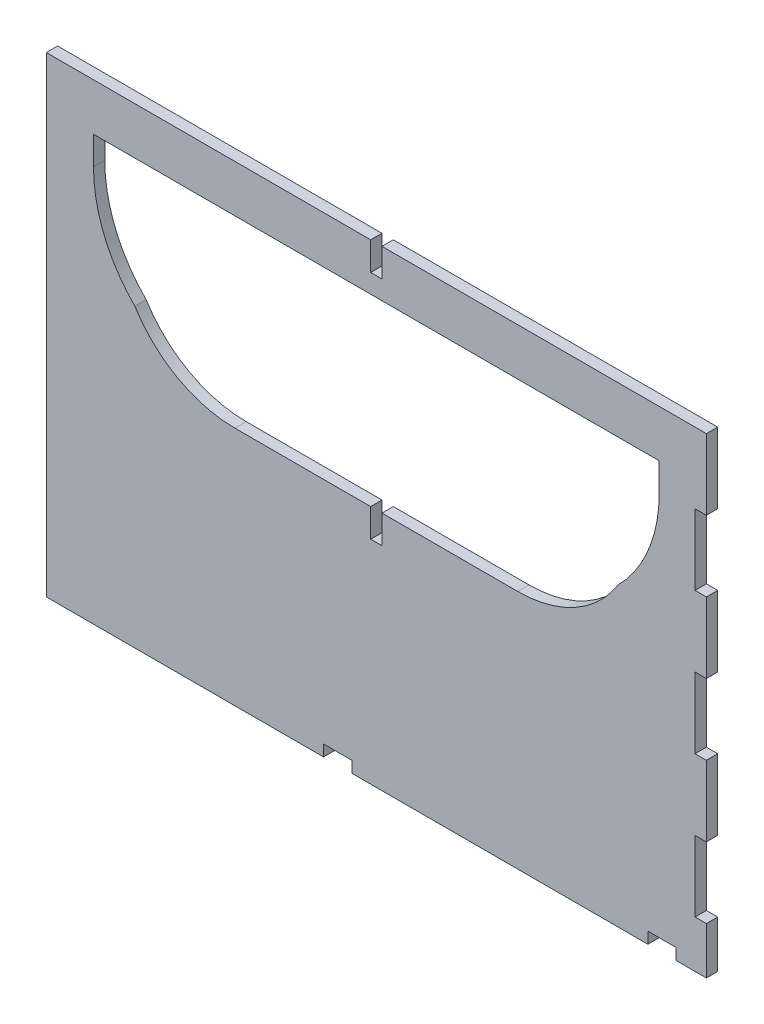
from build123d import *

# Parameters (mm, degrees)
SKETCH1_W           = 200
SKETCH1_H           = 150
BOSS_EXTRUDE1_DEPTH = 6
SKETCH3_W           = 100
SKETCH3_H           = 97.5
CUT_EXTRUDE1_DEPTH  = 6
BOSS_EXTRUDE3_DEPTH = 6
SKETCH5_W           = 6
SKETCH5_H           = 15
CUT_EXTRUDE2_DEPTH  = 6
SKETCH6_W           = 6
SKETCH6_H           = 37.5
CUT_EXTRUDE3_DEPTH  = 6
SKETCH8_W           = 350
SKETCH8_H           = 100
BOSS_EXTRUDE4_DEPTH = 6
LPATTERN1_COUNT     = 3
LPATTERN1_PITCH     = 75
SKETCH7_W           = 15
SKETCH7_H           = 6
CUT_EXTRUDE_S_DEPTH = 381.835922675


with BuildPart() as part:
    # Sketch1 → Boss-Extrude1 (new body)
    with BuildSketch(Plane.XY):
        with Locations((-100, 75)):
            Rectangle(SKETCH1_W, SKETCH1_H)
        with BuildLine():
            Line((-175, 110), (-175, 125))
            Line((-175, 125), (-25, 125))
            Line((-25, 125), (-25, 110))
            ThreePointArc((-25, 110), (-30.691670032, 81.340701386), (-46.902810588, 57.03125))
            ThreePointArc((-46.902810588, 57.03125), (-100, 27.5), (-153.097189412, 57.03125))
            ThreePointArc((-153.097189412, 57.03125), (-169.308329968, 81.340701386), (-175, 110))
        make_face(mode=Mode.SUBTRACT)
    extrude(amount=BOSS_EXTRUDE1_DEPTH)

    # Sketch3 → Cut-Extrude1 (cut)
    with BuildSketch(Plane.XY.offset(6)):
        with Locations((-150, 76.25)):
            Rectangle(SKETCH3_W, SKETCH3_H)
    extrude(amount=-CUT_EXTRUDE1_DEPTH, mode=Mode.SUBTRACT)

    # Sketch4 → Boss-Extrude3 (add)
    with BuildSketch(Plane.XY.offset(6)):
        with BuildLine():
            Line((-200, 27.5), (-250, 27.5))
            ThreePointArc((-250, 27.5), (-280.378472024, 35.379505335), (-303.097189412, 57.03125))
            ThreePointArc((-303.097189412, 57.03125), (-319.308329968, 81.340701386), (-325, 110))
            Line((-325, 110), (-325, 125))
            Line((-325, 125), (-200, 125))
            Line((-200, 125), (-200, 150))
            Line((-200, 150), (-350, 150))
            Line((-350, 150), (-350, 0))
            Line((-350, 0), (-200, 0))
            Line((-200, 0), (-200, 27.5))
        make_face()
    extrude(amount=-BOSS_EXTRUDE3_DEPTH)

    # Sketch5 → Cut-Extrude2 (cut)
    with BuildSketch(Plane.XY.offset(6)):
        with Locations((-175, 142.5)):
            Rectangle(SKETCH5_W, SKETCH5_H)
        with Locations((-175, 20)):
            Rectangle(SKETCH5_W, SKETCH5_H)
    extrude(amount=-CUT_EXTRUDE2_DEPTH, mode=Mode.SUBTRACT)

    # Sketch6 → Cut-Extrude3 (cut)
    with BuildSketch(Plane.XY.offset(6)):
        with Locations((-3, 93.75)):
            Rectangle(SKETCH6_W, SKETCH6_H)
    cut_extrude3 = extrude(amount=-CUT_EXTRUDE3_DEPTH, mode=Mode.SUBTRACT)

    # Sketch8 → Boss-Extrude4 (add)
    with BuildSketch(Plane.XY.offset(6)):
        with Locations((-175, -50)):
            Rectangle(SKETCH8_W, SKETCH8_H)
    extrude(amount=-BOSS_EXTRUDE4_DEPTH)

    # LPattern1: Cut-Extrude3 ×3
    with Locations(*[(0, -i * LPATTERN1_PITCH, 0) for i in range(1, LPATTERN1_COUNT)]):
        add(cut_extrude3, mode=Mode.SUBTRACT)

    # Sketch7 → Cut-Extrude s (cut, through all)
    with BuildSketch(Plane.XY.offset(6)):
        with Locations((-23.5, -97)):
            Rectangle(SKETCH7_W, SKETCH7_H)
        with Locations((-195.5, -97)):
            Rectangle(SKETCH7_W, SKETCH7_H)
    extrude(amount=-CUT_EXTRUDE_S_DEPTH, mode=Mode.SUBTRACT)


solid = part.part
